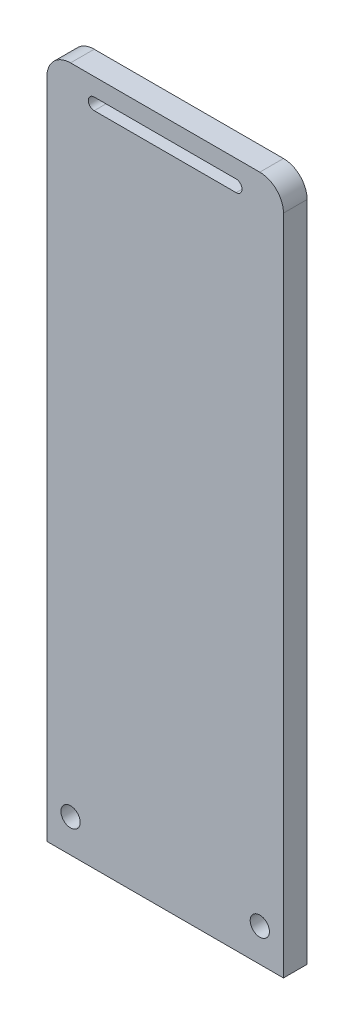
from build123d import *

# Parameters (mm, degrees)
SKETCH1_W           = 63.5
SKETCH1_H           = 184.15
BOSS_EXTRUDE1_DEPTH = 3.175
SKETCH3_R           = 2.5796875
CUT_EXTRUDE2_DEPTH  = 187.974884677
CUT_EXTRUDE3_DEPTH  = 187.974884677
FILLET1_R           = 6.35


with BuildPart() as part:
    # Sketch1 → Boss-Extrude1 (new, symmetric)
    with BuildSketch(Plane.XY):
        with Locations((0, 92.075)):
            Rectangle(SKETCH1_W, SKETCH1_H)
    extrude(amount=BOSS_EXTRUDE1_DEPTH, both=True)

    # Sketch3 → Cut-Extrude2 (cut, through all)
    with BuildSketch(Plane(origin=(0, 0, -3.175), x_dir=(-1, 0, 0), z_dir=(0, 0, -1))):
        with Locations((-25.4, 8.89)):
            Circle(SKETCH3_R)
        with Locations((25.4, 8.89)):
            Circle(SKETCH3_R)
    extrude(amount=-CUT_EXTRUDE2_DEPTH, mode=Mode.SUBTRACT)

    # Sketch4 → Cut-Extrude3 (cut, through all)
    with BuildSketch(Plane(origin=(0, 0, -3.175), x_dir=(-1, 0, 0), z_dir=(0, 0, -1))):
        with BuildLine():
            Line((-19.05, 179.3875), (19.05, 179.3875))
            ThreePointArc((19.05, 179.3875), (20.6375, 177.8), (19.05, 176.2125))
            Line((19.05, 176.2125), (-19.05, 176.2125))
            ThreePointArc((-19.05, 176.2125), (-20.6375, 177.8), (-19.05, 179.3875))
        make_face()
    extrude(amount=-CUT_EXTRUDE3_DEPTH, mode=Mode.SUBTRACT)

    # Fillet1
    fillet1_edges = [part.edges().sort_by_distance(p)[0] for p in [
        (-31.75, 184.15, 0),
        (31.75, 184.15, 0),
    ]]
    fillet(fillet1_edges, radius=FILLET1_R)


solid = part.part
